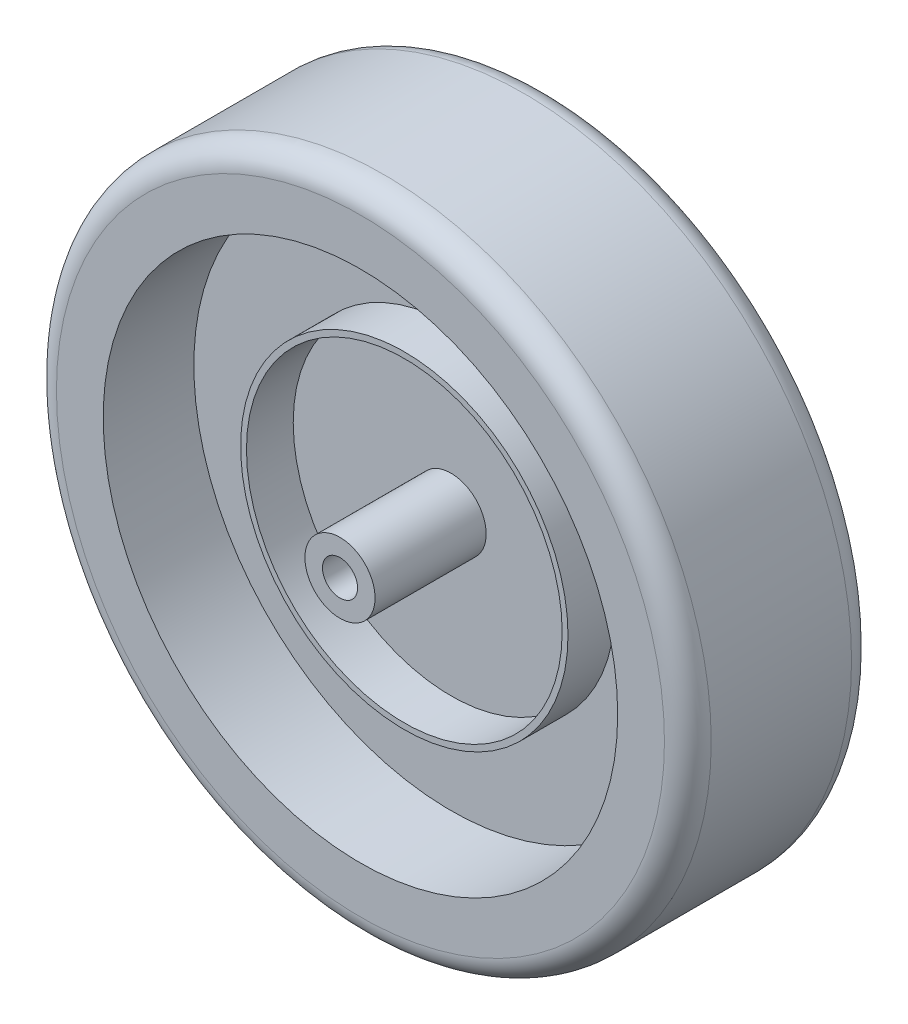
from build123d import *

# Parameters (mm, degrees)
SKETCH1_R      = 88.9
SKETCH1_R_2    = 69.85
EXTRUDE1_DEPTH = 25.4
FILLET1_R      = 6.35
SKETCH2_R      = 69.85
SKETCH2_R_2    = 9.525
EXTRUDE2_DEPTH = 0.79375
SKETCH3_R      = 9.525
SKETCH3_R_2    = 4.7625
EXTRUDE3_DEPTH = 30.1625
SKETCH4_R      = 44.45
SKETCH4_R_2    = 42.8625
EXTRUDE4_DEPTH = 12.7


with BuildPart() as part:
    # Sketch1 → Extrude1 (new, symmetric)
    with BuildSketch(Plane.XY):
        Circle(SKETCH1_R)
        Circle(SKETCH1_R_2, mode=Mode.SUBTRACT)
    extrude(amount=EXTRUDE1_DEPTH, both=True)

    # Fillet1
    fillet1_edges = [part.edges().sort_by_distance(p)[0] for p in [
        (-88.9, 0, -25.4),
        (-88.9, 0, 25.4),
    ]]
    fillet(fillet1_edges, radius=FILLET1_R)

    # Sketch2 → Extrude2 (add, symmetric)
    with BuildSketch(Plane.XY):
        Circle(SKETCH2_R)
        Circle(SKETCH2_R_2, mode=Mode.SUBTRACT)
    extrude(amount=EXTRUDE2_DEPTH, both=True)

    # Sketch3 → Extrude3 (add, symmetric)
    with BuildSketch(Plane.XY.offset(0.79375)):
        with Locations(Location((0, 0, 0), (0, 0, 180))):
            Circle(SKETCH3_R)
        with Locations(Location((0, 0, 0), (0, 0, 180))):
            Circle(SKETCH3_R_2, mode=Mode.SUBTRACT)
    extrude(amount=EXTRUDE3_DEPTH, both=True)

    # Sketch4 → Extrude4 (add, symmetric)
    with BuildSketch(Plane.XY.offset(0.79375)):
        Circle(SKETCH4_R)
        Circle(SKETCH4_R_2, mode=Mode.SUBTRACT)
    extrude(amount=EXTRUDE4_DEPTH, both=True)


solid = part.part
